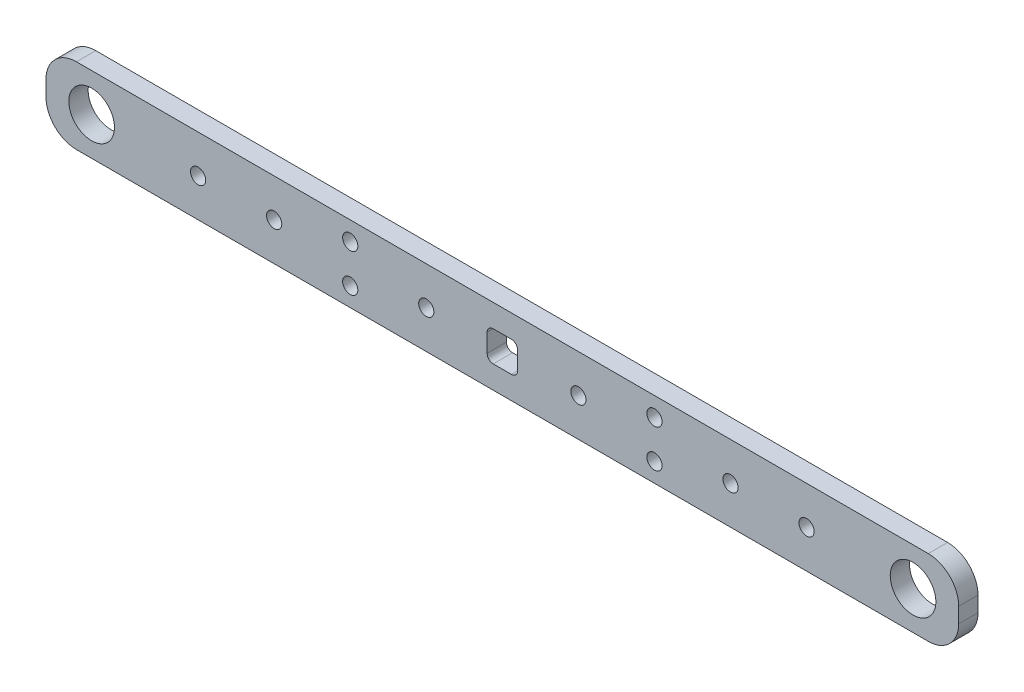
from build123d import *

# Parameters (mm, degrees)
SKETCH1_W               = 300
SKETCH1_H               = 25
SKETCH1_R               = 7.5
BOSS_EXTRUDE1_DEPTH     = 3.175
FILLET1_R               = 10
CUT_EXTRUDE1_DEPTH      = 151.653816746
CUT_EXTRUDE1_DEPTH_BACK = 151.653816746
SKETCH2_R               = 2.5
SKETCH2_W               = 10
SKETCH2_H               = 10
FILLET2_R               = 2
CUT_EXTRUDE2_DEPTH      = 151.653816746
CUT_EXTRUDE2_DEPTH_BACK = 151.653816746
SKETCH3_R               = 2.5


with BuildPart() as part:
    # Sketch1 → Boss-Extrude1 (new, symmetric)
    with BuildSketch(Plane.XY):
        Rectangle(SKETCH1_W, SKETCH1_H)
        with Locations((-135, 0)):
            Circle(SKETCH1_R, mode=Mode.SUBTRACT)
        with Locations(Location((135, 0, 0), (0, 0, 180))):
            Circle(SKETCH1_R, mode=Mode.SUBTRACT)
    extrude(amount=BOSS_EXTRUDE1_DEPTH, both=True)

    # Fillet1
    fillet1_edges = [part.edges().sort_by_distance(p)[0] for p in [
        (150, -12.5, 0),
        (-150, -12.5, 0),
        (-150, 12.5, 0),
        (150, 12.5, 0),
    ]]
    fillet(fillet1_edges, radius=FILLET1_R)

    # Sketch2 → Cut-Extrude1 (cut, two sides: drawn at the far end of the back side and taken through both)
    with BuildSketch(Plane.XY.offset(3.175).offset(-CUT_EXTRUDE1_DEPTH_BACK)):
        with Locations((-25, 0)):
            Circle(SKETCH2_R)
        with Locations((-75, 0)):
            Circle(SKETCH2_R)
        with Locations((25, 0)):
            Circle(SKETCH2_R)
        with Locations((75, 0)):
            Circle(SKETCH2_R)
        Rectangle(SKETCH2_W, SKETCH2_H)
    extrude(amount=CUT_EXTRUDE1_DEPTH + CUT_EXTRUDE1_DEPTH_BACK, mode=Mode.SUBTRACT)

    # Fillet2
    fillet2_edges = [part.edges().sort_by_distance(p)[0] for p in [
        (5, 5, 0),
        (5, -5, 0),
        (-5, -5, 0),
        (-5, 5, 0),
    ]]
    fillet(fillet2_edges, radius=FILLET2_R)

    # Sketch3 → Cut-Extrude2 (cut, two sides: drawn at the far end of the back side and taken through both)
    with BuildSketch(Plane.XY.offset(3.175).offset(-CUT_EXTRUDE2_DEPTH_BACK)):
        with Locations((-50, 6.25)):
            Circle(SKETCH3_R)
        with Locations((-50, -6.25)):
            Circle(SKETCH3_R)
        with Locations((50, -6.25)):
            Circle(SKETCH3_R)
        with Locations((50, 6.25)):
            Circle(SKETCH3_R)
        with Locations((-100, 0)):
            Circle(SKETCH3_R)
        with Locations((100, 0)):
            Circle(SKETCH3_R)
    extrude(amount=CUT_EXTRUDE2_DEPTH + CUT_EXTRUDE2_DEPTH_BACK, mode=Mode.SUBTRACT)


solid = part.part
